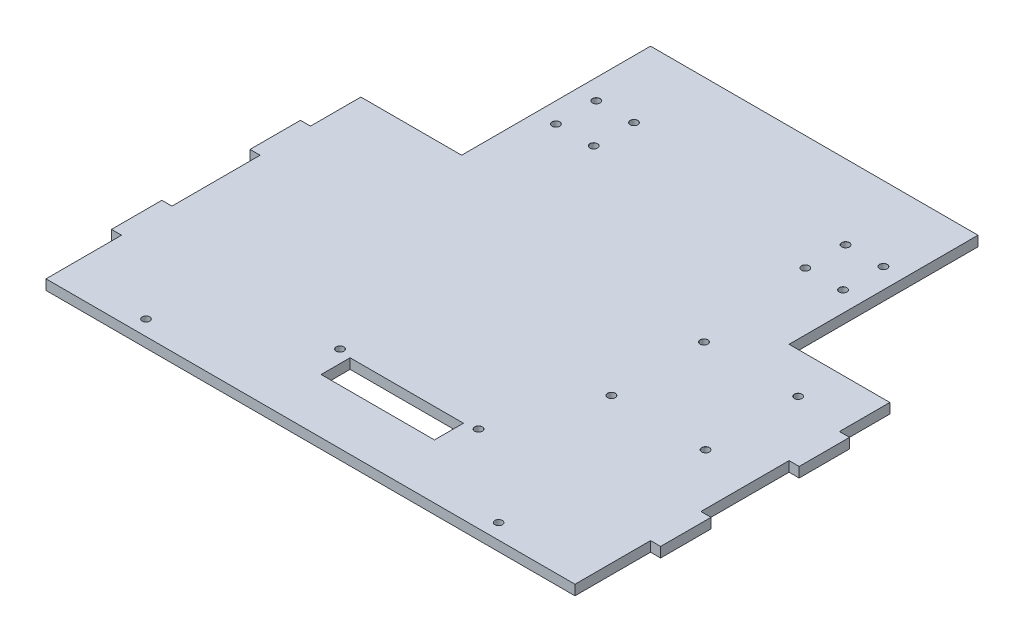
from build123d import *

# Parameters (mm, degrees)
SKETCH1_W                       = 210
SKETCH1_H                       = 200
BOSS_EXTRUDE1_DEPTH             = 4
SKETCH2_W                       = 40
SKETCH2_H                       = 75
CUT_EXTRUDE1_DEPTH              = 291.027584895
SKETCH5_W                       = 20
SKETCH5_H                       = 4
BOSS_EXTRUDE2_DEPTH             = 4
SKETCH6_W                       = 20
SKETCH6_H                       = 4
BOSS_EXTRUDE3_DEPTH             = 4
F_3_0MM_DOWEL_HOLE1_D           = 3
F_3_0MM_DOWEL_HOLE1_CSINK_D     = 3.05
F_3_0MM_DOWEL_HOLE1_CSINK_ANGLE = 90
SKETCH10_W                      = 45
SKETCH10_H                      = 11.5
CUT_EXTRUDE2_DEPTH              = 293.936853264
F_3_0MM_DOWEL_HOLE2_D           = 3
F_3_0MM_DOWEL_HOLE2_CSINK_D     = 3.05
F_3_0MM_DOWEL_HOLE2_CSINK_ANGLE = 90


with BuildPart() as part:
    # Sketch1 → Boss-Extrude1 (new body)
    with BuildSketch(Plane(origin=(0, 0, 0), x_dir=(1, 0, 0), z_dir=(0, 1, 0))):
        with Locations((105, 100)):
            Rectangle(SKETCH1_W, SKETCH1_H)
    extrude(amount=BOSS_EXTRUDE1_DEPTH)

    # Sketch2 → Cut-Extrude1 (cut, through all)
    with BuildSketch(Plane(origin=(0, 4, 0), x_dir=(1, 0, 0), z_dir=(0, 1, 0))):
        with Locations((190, 162.5)):
            Rectangle(SKETCH2_W, SKETCH2_H)
        with Locations((20, 162.5)):
            Rectangle(SKETCH2_W, SKETCH2_H)
    extrude(amount=-CUT_EXTRUDE1_DEPTH, mode=Mode.SUBTRACT)

    # Sketch5 → Boss-Extrude2 (add)
    with BuildSketch(Plane(origin=(210, 0, 0), x_dir=(0, 0, -1), z_dir=(1, 0, 0))):
        with Locations((95, 2)):
            Rectangle(SKETCH5_W, SKETCH5_H)
        with Locations((40, 2)):
            Rectangle(SKETCH5_W, SKETCH5_H)
    extrude(amount=BOSS_EXTRUDE2_DEPTH)

    # Sketch6 → Boss-Extrude3 (add)
    with BuildSketch(Plane.ZY):
        with Locations((-95, 2)):
            Rectangle(SKETCH6_W, SKETCH6_H)
        with Locations((-40, 2)):
            Rectangle(SKETCH6_W, SKETCH6_H)
    extrude(amount=BOSS_EXTRUDE3_DEPTH)

    # Ø3.0mm Dowel Hole1 (through all)
    with Locations(Plane(origin=(0, 4, 0), x_dir=(1, 0, 0), z_dir=(0, 1, 0))):
        with Locations((137.499998178, 34.210002794), (82.5, 34.22415936), (162, 170.432778178), (162, 154.432778178), (147, 154.432778178), (147, 170.432778178), (63, 170.432778178), (48, 170.432778178), (48, 154.432778178), (63, 154.432778178), (189.704460004, 108.892072525), (189.704460004, 72.150272201), (152.324959132, 72.150272201), (152.324959132, 108.892072525)):
            CounterSinkHole(F_3_0MM_DOWEL_HOLE1_D / 2, F_3_0MM_DOWEL_HOLE1_CSINK_D / 2, counter_sink_angle=F_3_0MM_DOWEL_HOLE1_CSINK_ANGLE)

    # Sketch10 → Cut-Extrude2 (cut, through all)
    with BuildSketch(Plane(origin=(0, 4, 0), x_dir=(1, 0, 0), z_dir=(0, 1, 0))):
        with Locations((110, 27.47415936)):
            Rectangle(SKETCH10_W, SKETCH10_H)
    extrude(amount=-CUT_EXTRUDE2_DEPTH, mode=Mode.SUBTRACT)

    # Ø3.0mm Dowel Hole2 (through all)
    with Locations(Plane(origin=(0, 0, 0), x_dir=(-1, 0, 0), z_dir=(0, -1, 0))):
        with Locations((-33.660254038, 6.028412794), (-173.660254038, 6.028412794)):
            CounterSinkHole(F_3_0MM_DOWEL_HOLE2_D / 2, F_3_0MM_DOWEL_HOLE2_CSINK_D / 2, counter_sink_angle=F_3_0MM_DOWEL_HOLE2_CSINK_ANGLE)


solid = part.part
